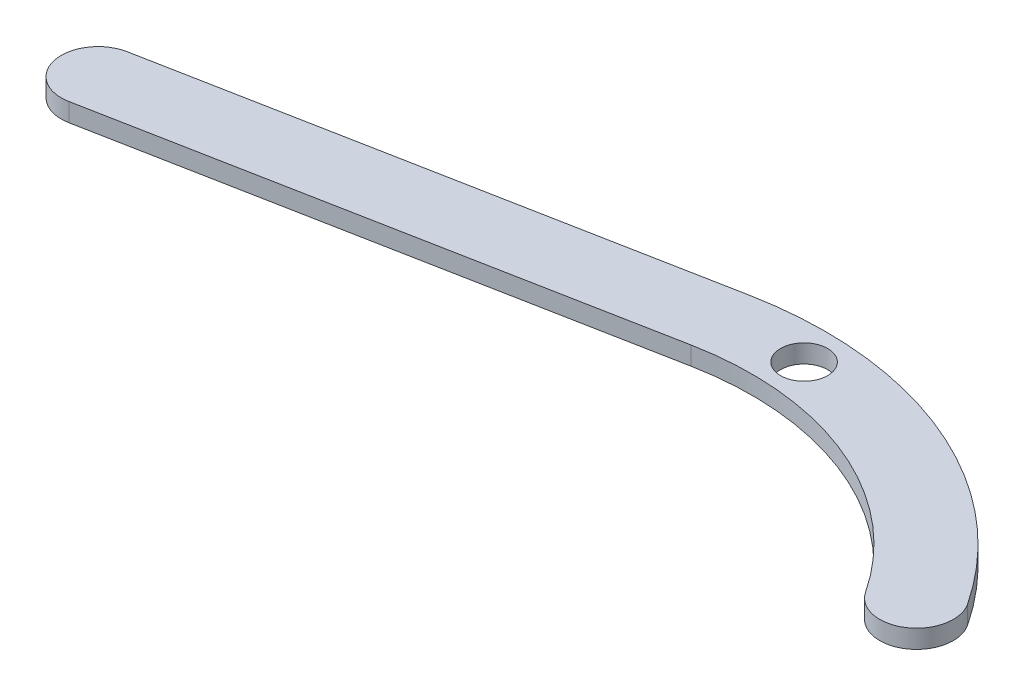
from build123d import *

# Parameters (mm, degrees)
BOSS_EXTRUDE1_DEPTH = 1.5875
SKETCH3_R           = 2.032
CUT_EXTRUDE1_DEPTH  = 80.437624756


with BuildPart() as part:
    # Sketch2 → Boss-Extrude1 (new body)
    with BuildSketch(Plane(origin=(0, 0, 0), x_dir=(1, 0, 0), z_dir=(0, 1, 0))):
        with BuildLine():
            Line((44.536177097, 1.424957669), (-0.512568563, -7.225605856))
            ThreePointArc((-0.512568563, -7.225605856), (-3.031855718, -10.942384331), (0.684922757, -13.461671486))
            Line((0.684922757, -13.461671486), (45.733668417, -4.811107961))
            ThreePointArc((45.733668417, -4.811107961), (60.383311669, -6.347108045), (71.717083543, -15.755453212))
            ThreePointArc((71.717083543, -15.755453212), (76.116254433, -16.654644785), (77.015446005, -12.255473895))
            ThreePointArc((77.015446005, -12.255473895), (62.848231163, -0.495042436), (44.536177097, 1.424957669))
        make_face()
    extrude(amount=BOSS_EXTRUDE1_DEPTH)

    # Sketch3 → Cut-Extrude1 (cut, through all)
    with BuildSketch(Plane(origin=(0, 1.5875, 0), x_dir=(1, 0, 0), z_dir=(0, 1, 0))):
        with Locations(Location((51.871233594, -1.212563202, 0), (0, 0, 270))):
            Circle(SKETCH3_R)
    extrude(amount=-CUT_EXTRUDE1_DEPTH, mode=Mode.SUBTRACT)


solid = part.part
